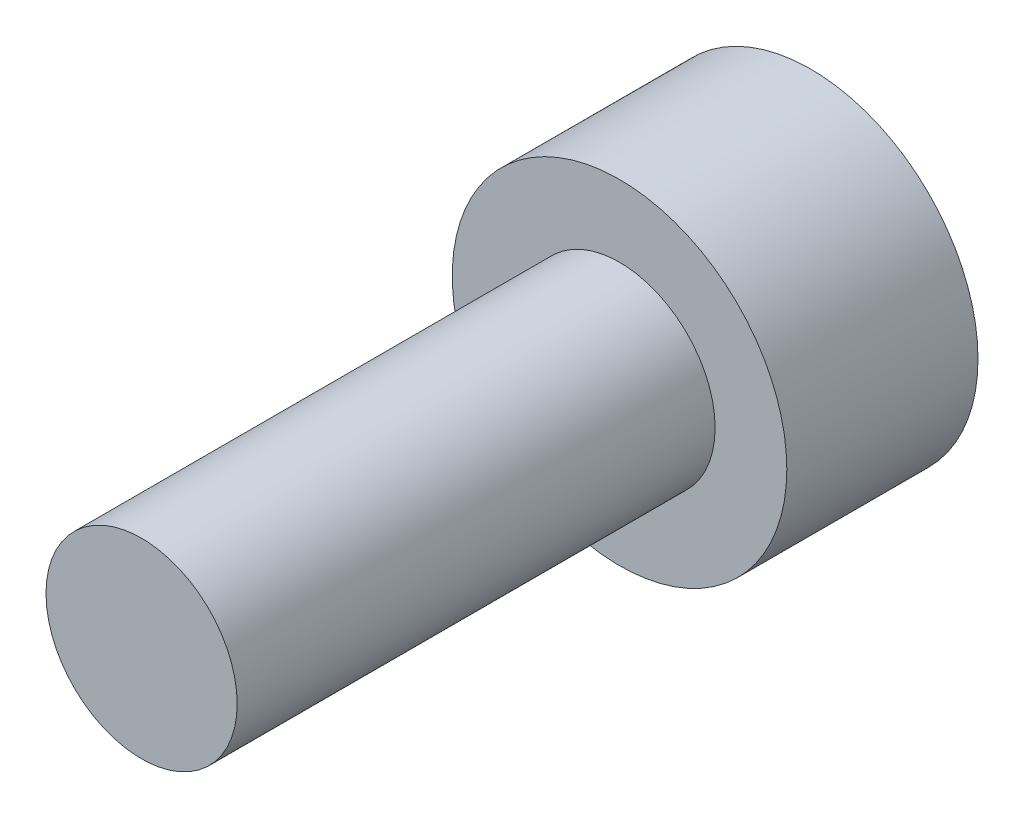
from build123d import *

# Parameters (mm, degrees)
SKETCH_1_R      = 3.5
EXTRUDE_1_DEPTH = 4
SKETCH_2_R      = 2
EXTRUDE_2_DEPTH = 10


with BuildPart() as part:
    # 草图1 → 凸台-拉伸1 (new body)
    with BuildSketch(Plane.XY):
        Circle(SKETCH_1_R)
    extrude(amount=EXTRUDE_1_DEPTH)

    # 草图2 → 凸台-拉伸2 (add)
    with BuildSketch(Plane.XY.offset(4)):
        Circle(SKETCH_2_R)
    extrude(amount=EXTRUDE_2_DEPTH)


solid = part.part
